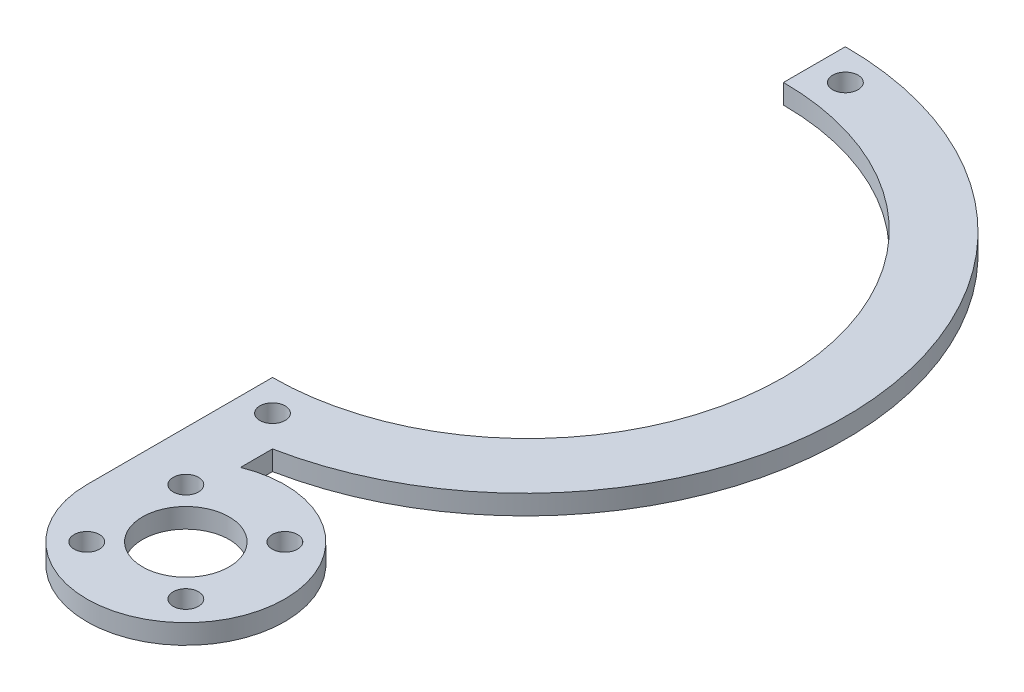
from build123d import *

# Parameters (mm, degrees)
SKETCH1_R           = 2.05
SKETCH1_R_2         = 7
BOSS_EXTRUDE1_DEPTH = 3.175


with BuildPart() as part:
    # Sketch1 → Boss-Extrude1 (new body)
    with BuildSketch(Plane(origin=(0, 0, 0), x_dir=(1, 0, 0), z_dir=(0, 1, 0))):
        with BuildLine():
            Line((-16, 122.55), (-16, 112.55))
            ThreePointArc((-16, 112.55), (25.275, 71.275), (-16, 30))
            Line((-16, 30), (-16, 0))
            ThreePointArc((-16, 0), (0, -16), (16, 0))
            ThreePointArc((16, 0), (8.94427191, 13.266499161), (-6, 14.832396974))
            Line((-6, 14.832396974), (-6, 20))
            ThreePointArc((-6, 20), (35.518206733, 75.811148877), (-16, 122.55))
        make_face()
        with Locations(Location((-8, 8, 0), (0, 0, 270))):
            Circle(SKETCH1_R, mode=Mode.SUBTRACT)
        with Locations(Location((8, 8, 0), (0, 0, 270))):
            Circle(SKETCH1_R, mode=Mode.SUBTRACT)
        with Locations(Location((8, -8, 0), (0, 0, 270))):
            Circle(SKETCH1_R, mode=Mode.SUBTRACT)
        with Locations(Location((-8, -8, 0), (0, 0, 270))):
            Circle(SKETCH1_R, mode=Mode.SUBTRACT)
        with Locations(Location((-11, 25, 0), (0, 0, 270))):
            Circle(SKETCH1_R, mode=Mode.SUBTRACT)
        with Locations(Location((-11, 117.55, 0), (0, 0, 90))):
            Circle(SKETCH1_R, mode=Mode.SUBTRACT)
        with Locations(Location((0, 0, 0), (0, 0, 270))):
            Circle(SKETCH1_R_2, mode=Mode.SUBTRACT)
    extrude(amount=BOSS_EXTRUDE1_DEPTH)


solid = part.part
